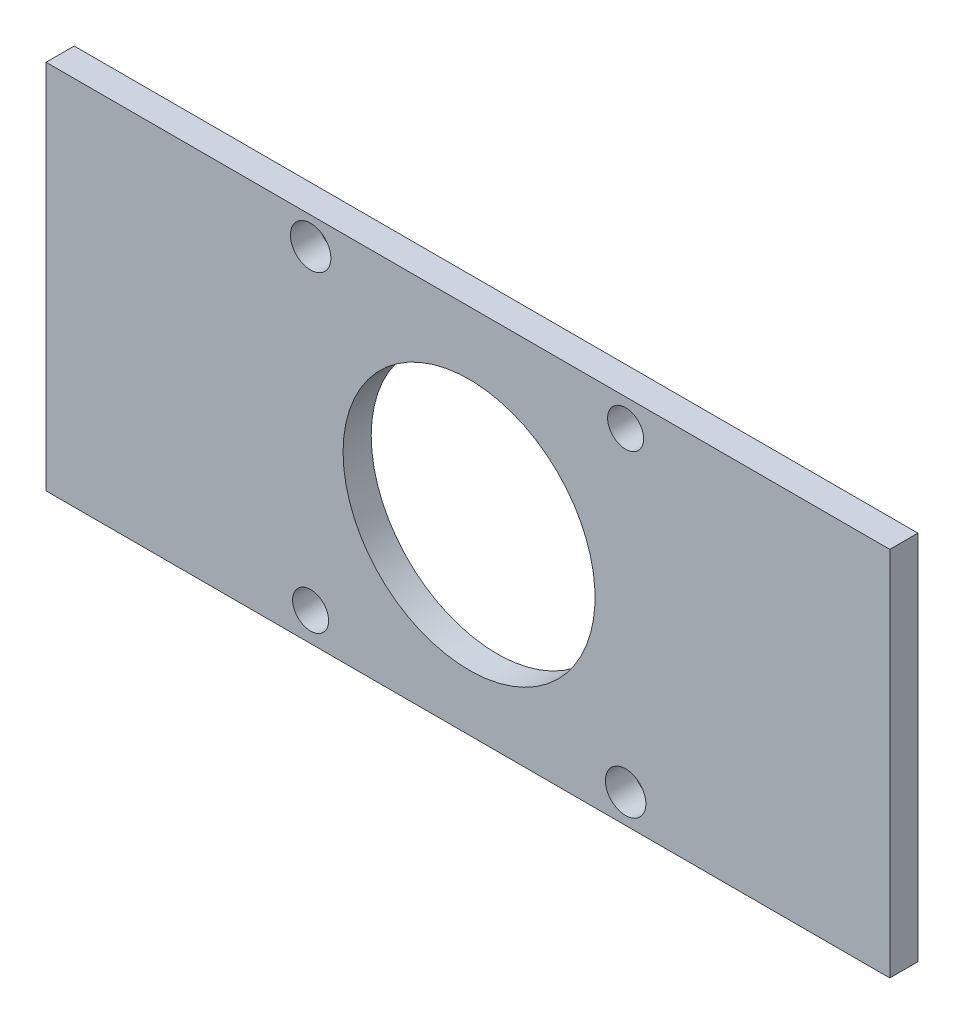
from build123d import *

# Parameters (mm, degrees)
SKETCH1_W           = 95.25
SKETCH1_H           = 41.91
BOSS_EXTRUDE1_DEPTH = 1.5875
SKETCH2_R           = 14.224
SKETCH2_R_2         = 2.286
SKETCH2_R_3         = 2.032
CUT_EXTRUDE1_DEPTH  = 3.175


with BuildPart() as part:
    # Sketch1 → Boss-Extrude1 (new, symmetric)
    with BuildSketch(Plane.XY):
        with Locations((-2.54, -2.667)):
            Rectangle(SKETCH1_W, SKETCH1_H)
    extrude(amount=BOSS_EXTRUDE1_DEPTH, both=True)

    # Sketch2 → Cut-Extrude1 (cut)
    with BuildSketch(Plane(origin=(0, 0, -1.5875), x_dir=(-1, 0, 0), z_dir=(0, 0, -1))):
        with Locations((2.413, -3.048)):
            Circle(SKETCH2_R)
        with Locations((-15.260103904, -20.364606719)):
            Circle(SKETCH2_R_2)
        with Locations((-15.260103904, 15.195393281)):
            Circle(SKETCH2_R_3)
        with Locations((20.299896096, 15.195393281)):
            Circle(SKETCH2_R_2)
        with Locations((20.299896096, -20.364606719)):
            Circle(SKETCH2_R_3)
    extrude(amount=-CUT_EXTRUDE1_DEPTH, mode=Mode.SUBTRACT)


solid = part.part
